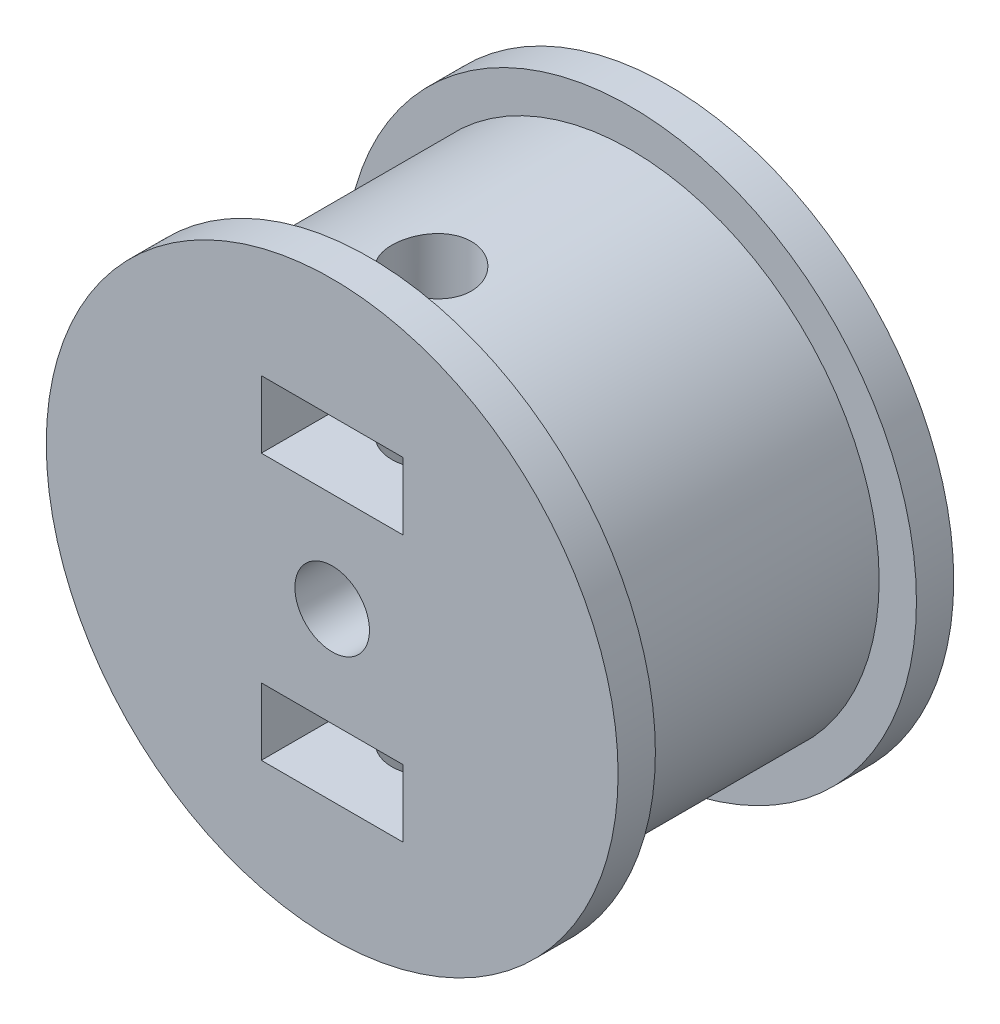
from build123d import *

# Parameters (mm, degrees)
SKETCH_2_R          = 1.6
CUT_EXTRUDE_1_DEPTH = 22.136461388
CUT_EXTRUDE_START   = -4
SKETCH_2_4_R        = 1.6
CUT_EXTRUDE_2_DEPTH = 2.7


with BuildPart() as part:
    # Эскиз1 → Повернуть1 (revolve)
    with BuildSketch(Plane(origin=(0, 0, 0), x_dir=(0, 0, -1), z_dir=(1, 0, 0))):
        Polygon((0, 11.5), (0, 1.5), (8, 1.5), (8, 7), (13.5, 7), (13.5, 11.5), (12, 11.5), (12, 10), (1.5, 10), (1.5, 11.5), align=None)
    revolve(axis=Axis((0, 0, 0), (0, 0, -1)))

    # Эскиз2 → Вырез-Вытянуть1 (cut, through all)
    with BuildSketch(Plane(origin=(0, 0, 0), x_dir=(1, 0, 0), z_dir=(0, 1, 0))):
        with Locations((0, 4)):
            Circle(SKETCH_2_R)
    cut_extrude_1 = extrude(amount=-CUT_EXTRUDE_1_DEPTH, mode=Mode.SUBTRACT)

    # Эскиз2<4> → Вырез-Вытянуть2 (cut)
    with BuildSketch(Plane(origin=(0, 0, 0), x_dir=(1, 0, 0), z_dir=(0, 1, 0)).offset(CUT_EXTRUDE_START)):
        Polygon((0, 7.290896534), (-2.85, 5.645448267), (-2.85, 2.354551733), (-2.85, 0), (2.85, 0), (2.85, 2.354551733), (2.85, 5.645448267), align=None)
        with Locations((0, 4)):
            Circle(SKETCH_2_4_R, mode=Mode.SUBTRACT)
    cut_extrude_2 = extrude(amount=-CUT_EXTRUDE_2_DEPTH, mode=Mode.SUBTRACT)

    # Зеркальное отражение1: Вырез-Вытянуть1, Вырез-Вытянуть2 across plane
    add(cut_extrude_1.mirror(Plane.ZX), mode=Mode.SUBTRACT)
    add(cut_extrude_2.mirror(Plane.ZX), mode=Mode.SUBTRACT)


solid = part.part
